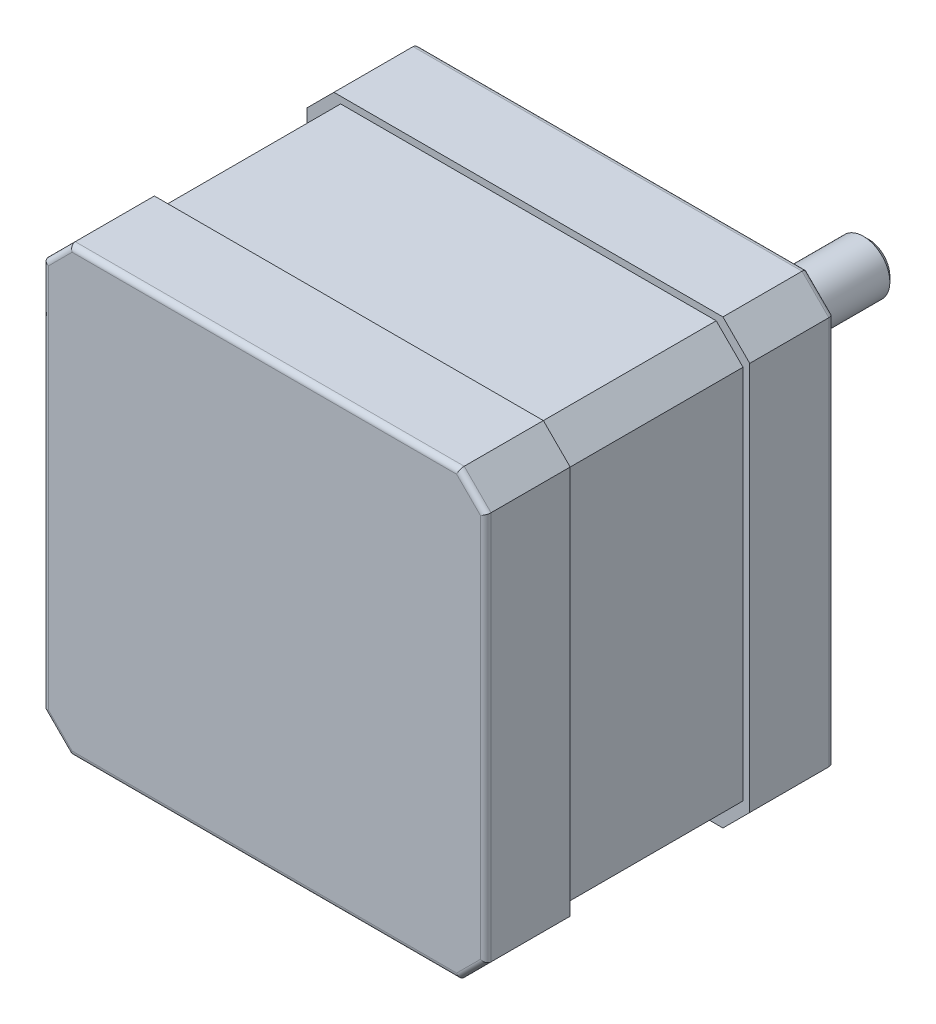
from build123d import *

# Parameters (mm, degrees)
SKETCH1_W           = 41.91
SKETCH1_H           = 41.91
BOSS_EXTRUDE1_DEPTH = 8
SKETCH2_W           = 40.64
SKETCH2_H           = 40.64
BOSS_EXTRUDE2_DEPTH = 17
SKETCH3_W           = 41.91
SKETCH3_H           = 41.91
BOSS_EXTRUDE3_DEPTH = 8
CHAMFER1_SIZE       = 2.54
CHAMFER2_SIZE       = 2.54
SKETCH4_R           = 10.9982
BOSS_EXTRUDE4_DEPTH = 2
SKETCH5_R           = 2.5
BOSS_EXTRUDE5_DEPTH = 22.225
CHAMFER3_SIZE       = 0.508
FILLET2_R           = 0.508
SKETCH6_R           = 1.397
CUT_EXTRUDE1_DEPTH  = 5.08


with BuildPart() as part:
    # Sketch1 → Boss-Extrude1 (new body)
    with BuildSketch(Plane.XY):
        Rectangle(SKETCH1_W, SKETCH1_H)
    extrude(amount=BOSS_EXTRUDE1_DEPTH)

    # Sketch2 → Boss-Extrude2 (add)
    with BuildSketch(Plane.XY.offset(8)):
        Rectangle(SKETCH2_W, SKETCH2_H)
    extrude(amount=BOSS_EXTRUDE2_DEPTH)

    # Sketch3 → Boss-Extrude3 (add)
    with BuildSketch(Plane.XY.offset(25)):
        Rectangle(SKETCH3_W, SKETCH3_H)
    extrude(amount=BOSS_EXTRUDE3_DEPTH)

    # Chamfer1
    chamfer1_edges = [part.edges().sort_by_distance(p)[0] for p in [
        (20.32, -20.32, 16.5),
        (20.32, 20.32, 16.5),
        (-20.32, 20.32, 16.5),
        (-20.32, -20.32, 16.5),
    ]]
    chamfer(chamfer1_edges, length=CHAMFER1_SIZE)

    # Chamfer2
    chamfer2_edges = [part.edges().sort_by_distance(p)[0] for p in [
        (20.955, -20.955, 29),
        (20.955, 20.955, 29),
        (-20.955, 20.955, 29),
        (-20.955, -20.955, 29),
        (20.955, -20.955, 4),
        (-20.955, -20.955, 4),
        (-20.955, 20.955, 4),
        (20.955, 20.955, 4),
    ]]
    chamfer(chamfer2_edges, length=CHAMFER2_SIZE)

    # Sketch4 → Boss-Extrude4 (add)
    with BuildSketch(Plane(origin=(0, 0, 0), x_dir=(-1, 0, 0), z_dir=(0, 0, -1))):
        Circle(SKETCH4_R)
    extrude(amount=BOSS_EXTRUDE4_DEPTH)

    # Sketch5 → Boss-Extrude5 (add)
    with BuildSketch(Plane(origin=(0, 0, -2), x_dir=(-1, 0, 0), z_dir=(0, 0, -1))):
        Circle(SKETCH5_R)
    extrude(amount=BOSS_EXTRUDE5_DEPTH)

    # Chamfer3
    chamfer3_edges = [part.edges().sort_by_distance(p)[0] for p in [
        (2.5, 0, -24.225),
    ]]
    chamfer(chamfer3_edges, length=CHAMFER3_SIZE)

    # Fillet2
    fillet2_edges = [part.edges().sort_by_distance(p)[0] for p in [
        (10.9982, 0, 0),
        (0, 20.955, 33),
        (20.955, 0, 33),
        (-20.955, 0, 33),
        (0, -20.955, 33),
        (19.685, -19.685, 33),
        (-19.685, -19.685, 33),
        (-19.685, 19.685, 33),
        (19.685, 19.685, 33),
        (0, 20.955, 0),
        (20.955, 0, 0),
        (0, -20.955, 0),
        (-20.955, 0, 0),
        (19.685, -19.685, 0),
        (-19.685, -19.685, 0),
        (-19.685, 19.685, 0),
        (19.685, 19.685, 0),
    ]]
    fillet(fillet2_edges, radius=FILLET2_R)

    # Sketch6 → Cut-Extrude1 (cut)
    with BuildSketch(Plane(origin=(0, 0, 0), x_dir=(-1, 0, 0), z_dir=(0, 0, -1))):
        with Locations((15.5, 15.5)):
            Circle(SKETCH6_R)
        with Locations((-15.5, -15.5)):
            Circle(SKETCH6_R)
    extrude(amount=-CUT_EXTRUDE1_DEPTH, mode=Mode.SUBTRACT)


solid = part.part
